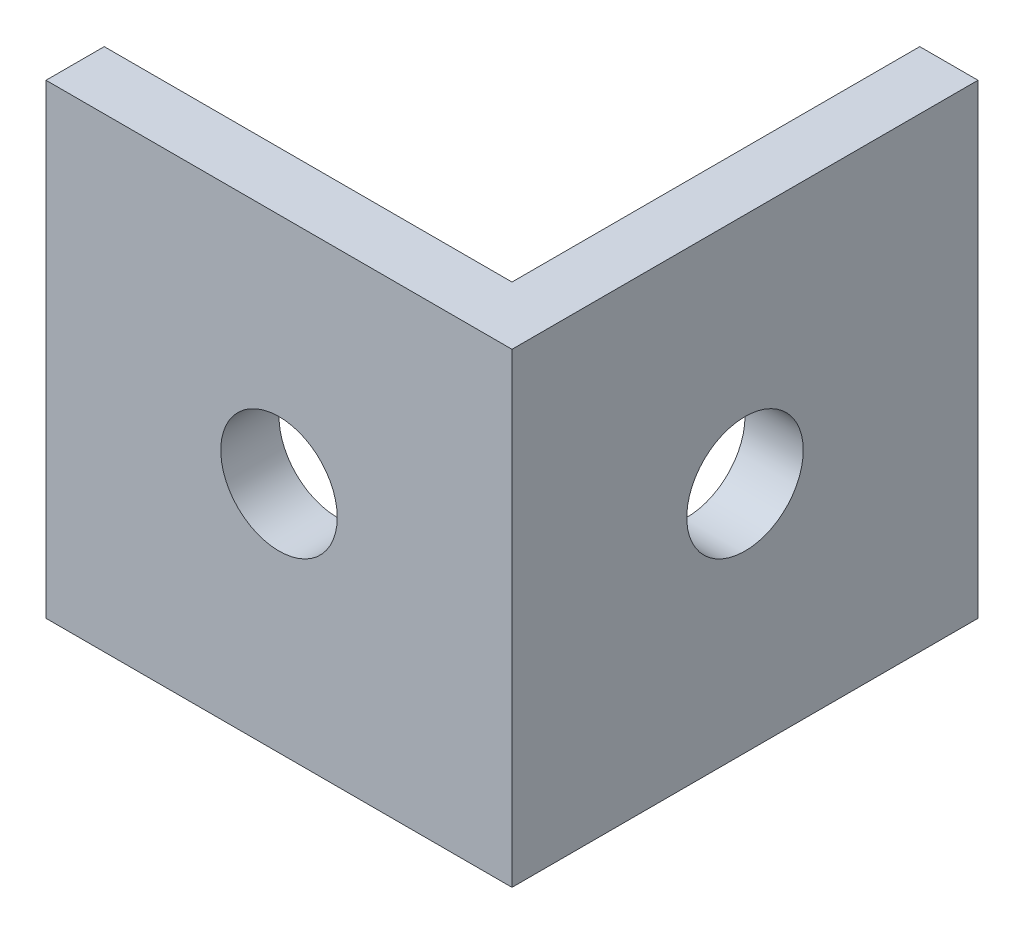
from build123d import *

# Parameters (mm, degrees)
BOSS_EXTRUDE1_DEPTH = 25.4
SKETCH2_R           = 3.175
CUT_EXTRUDE1_DEPTH  = 25.4
SKETCH3_R           = 3.175
CUT_EXTRUDE2_DEPTH  = 25.4


with BuildPart() as part:
    # Sketch1 → Boss-Extrude1 (new body)
    with BuildSketch(Plane(origin=(0, 0, 0), x_dir=(1, 0, 0), z_dir=(0, 1, 0))):
        Polygon((0, 0), (25.4, 0), (25.4, 25.4), (22.225, 25.4), (22.225, 3.175), (0, 3.175), align=None)
    extrude(amount=BOSS_EXTRUDE1_DEPTH)

    # Sketch2 → Cut-Extrude1 (cut)
    with BuildSketch(Plane(origin=(25.4, 0, 0), x_dir=(0, 0, -1), z_dir=(1, 0, 0))):
        with Locations((12.7, 12.7)):
            Circle(SKETCH2_R)
    extrude(amount=-CUT_EXTRUDE1_DEPTH, mode=Mode.SUBTRACT)

    # Sketch3 → Cut-Extrude2 (cut)
    with BuildSketch(Plane.XY):
        with Locations((12.7, 12.7)):
            Circle(SKETCH3_R)
    extrude(amount=-CUT_EXTRUDE2_DEPTH, mode=Mode.SUBTRACT)


solid = part.part
